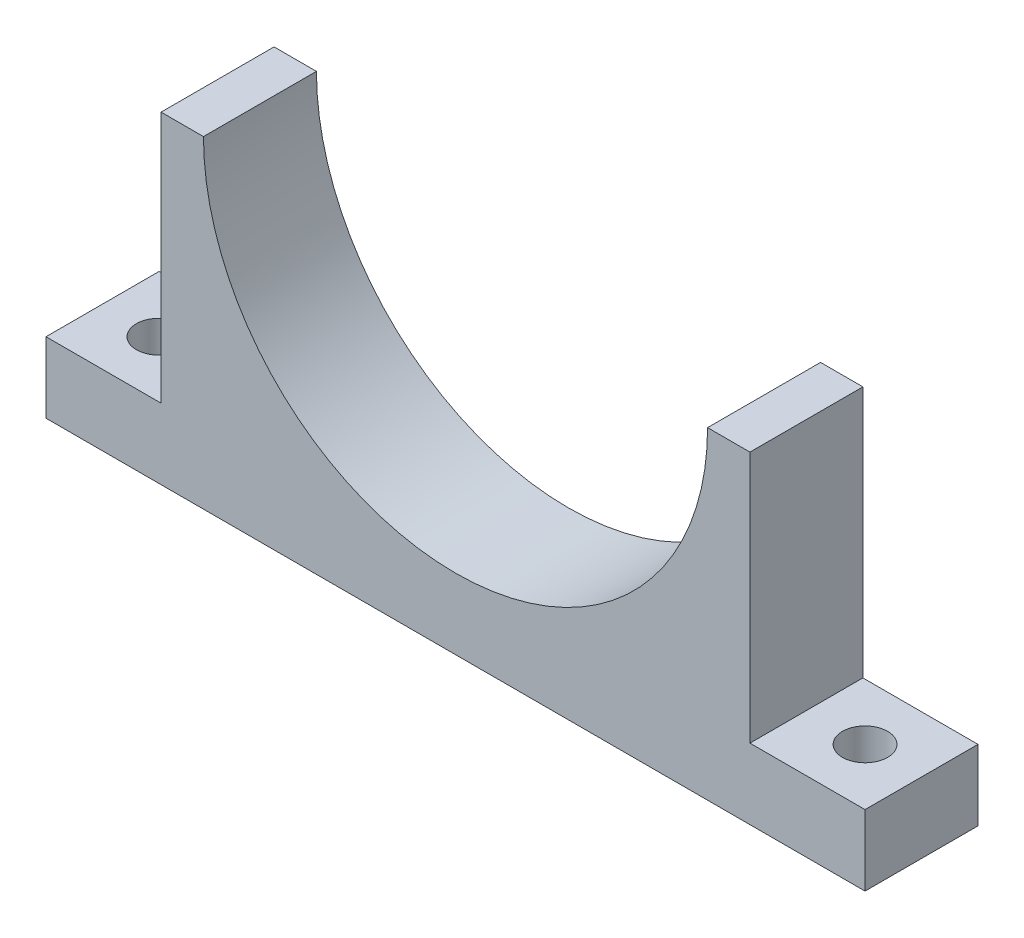
from build123d import *

# Parameters (mm, degrees)
EXTRUDE_1_DEPTH     = 8
SKETCH_2_R          = 1.6
CUT_EXTRUDE_1_DEPTH = 8


with BuildPart() as part:
    # ｽｹｯﾁ1 → ﾎﾞｽ - 押し出し1 (new body)
    with BuildSketch(Plane.XY):
        with BuildLine():
            Line((-17.85, 0), (-20.85, 0))
            Line((-20.85, 0), (-20.85, -17.85))
            Line((-20.85, -17.85), (-29, -17.85))
            Line((-29, -17.85), (-29, -22.85))
            Line((-29, -22.85), (29, -22.85))
            Line((29, -22.85), (29, -17.85))
            Line((29, -17.85), (20.85, -17.85))
            Line((20.85, -17.85), (20.85, 0))
            Line((20.85, 0), (17.85, 0))
            ThreePointArc((17.85, 0), (0, -17.85), (-17.85, 0))
        make_face()
    extrude(amount=EXTRUDE_1_DEPTH)

    # ｽｹｯﾁ2 → ｶｯﾄ - 押し出し1 (cut)
    with BuildSketch(Plane.XZ.offset(22.85)):
        with Locations(Location((-25, 4, 0), (0, 0, 270))):
            Circle(SKETCH_2_R)
        with Locations(Location((25, 4, 0), (0, 0, 270))):
            Circle(SKETCH_2_R)
    extrude(amount=-CUT_EXTRUDE_1_DEPTH, mode=Mode.SUBTRACT)


solid = part.part
